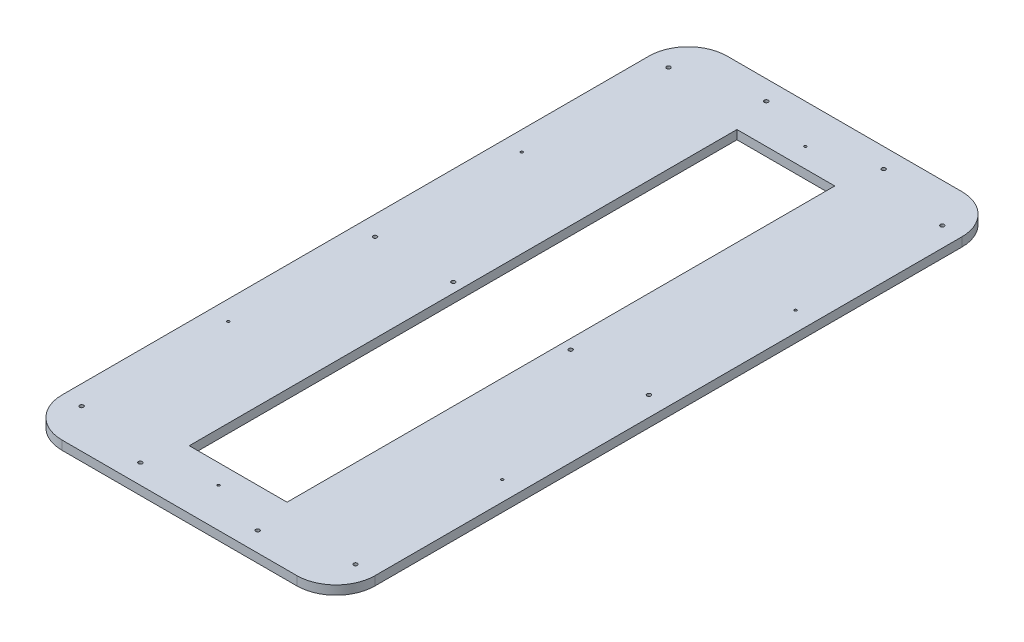
from build123d import *

# Parameters (mm, degrees)
SKETCH1_W                 = 203.2
SKETCH1_H                 = 431.8
BOSS_EXTRUDE1_DEPTH       = 5.8
M3X0_5_TAPPED_HOLE2_D     = 2.5
M3X0_5_TAPPED_HOLE2_DEPTH = 7.5
M3X0_5_TAPPED_HOLE2_TIP   = 0.751075774
SKETCH7_W                 = 63.5
SKETCH7_H                 = 355.6
CUT_EXTRUDE2_DEPTH        = 478.257917692
FILLET1_R                 = 25.4
M3X0_5_TAPPED_HOLE1_D     = 2.5
M3X0_5_TAPPED_HOLE1_DEPTH = 7.5
M3X0_5_TAPPED_HOLE1_TIP   = 0.751075774
SKETCH10_R                = 0.79375
CUT_EXTRUDE3_DEPTH        = 478.257917692


with BuildPart() as part:
    # Sketch1 → Boss-Extrude1 (new body)
    with BuildSketch(Plane(origin=(0, 0, 0), x_dir=(1, 0, 0), z_dir=(0, 1, 0))):
        with Locations((101.6, 215.9)):
            Rectangle(SKETCH1_W, SKETCH1_H)
    extrude(amount=BOSS_EXTRUDE1_DEPTH)

    # M3x0.5 Tapped Hole2
    with Locations(Plane(origin=(0, 5.8, 0), x_dir=(-1, 0, 0), z_dir=(0, 1, 0))):
        with Locations((-63.5, -419.1), (-139.7, -419.1), (-63.5, -215.9), (-139.7, -215.9), (-63.5, -12.7), (-139.7, -12.7)):
            Hole(M3X0_5_TAPPED_HOLE2_D / 2, depth=M3X0_5_TAPPED_HOLE2_DEPTH)
            with Locations((0, 0, -(M3X0_5_TAPPED_HOLE2_DEPTH + M3X0_5_TAPPED_HOLE2_TIP / 2))):  # 118° drill point
                Cone(0, M3X0_5_TAPPED_HOLE2_D / 2, M3X0_5_TAPPED_HOLE2_TIP, mode=Mode.SUBTRACT)

    # Sketch7 → Cut-Extrude2 (cut, through all)
    with BuildSketch(Plane(origin=(0, 5.8, 0), x_dir=(1, 0, 0), z_dir=(0, 1, 0))):
        with Locations((101.6, 215.9)):
            Rectangle(SKETCH7_W, SKETCH7_H)
    extrude(amount=-CUT_EXTRUDE2_DEPTH, mode=Mode.SUBTRACT)

    # Fillet1
    fillet1_edges = [part.edges().sort_by_distance(p)[0] for p in [
        (0, 2.9, -431.8),
        (203.2, 2.9, -431.8),
        (203.2, 2.9, 0),
        (0, 2.9, 0),
    ]]
    fillet(fillet1_edges, radius=FILLET1_R)

    # M3x0.5 Tapped Hole1
    with Locations(Plane(origin=(0, 5.8, 0), x_dir=(-1, 0, 0), z_dir=(0, 1, 0))):
        with Locations((-190.5, -406.4), (-190.5, -25.4), (-12.7, -25.4), (-12.7, -406.4), (-190.5, -215.9), (-12.7, -215.9)):
            Hole(M3X0_5_TAPPED_HOLE1_D / 2, depth=M3X0_5_TAPPED_HOLE1_DEPTH)
            with Locations((0, 0, -(M3X0_5_TAPPED_HOLE1_DEPTH + M3X0_5_TAPPED_HOLE1_TIP / 2))):  # 118° drill point
                Cone(0, M3X0_5_TAPPED_HOLE1_D / 2, M3X0_5_TAPPED_HOLE1_TIP, mode=Mode.SUBTRACT)

    # Sketch10 → Cut-Extrude3 (cut, through all)
    with BuildSketch(Plane(origin=(0, 5.8, 0), x_dir=(1, 0, 0), z_dir=(0, 1, 0))):
        with Locations(Location((12.7, 311.15, 0), (0, 0, 270))):
            Circle(SKETCH10_R)
        with Locations(Location((190.5, 311.15, 0), (0, 0, 270))):
            Circle(SKETCH10_R)
        with Locations(Location((101.6, 406.4, 0), (0, 0, 270))):
            Circle(SKETCH10_R)
        with Locations(Location((101.6, 25.4, 0), (0, 0, 90))):
            Circle(SKETCH10_R)
        with Locations(Location((190.5, 120.65, 0), (0, 0, 90))):
            Circle(SKETCH10_R)
        with Locations(Location((12.7, 120.65, 0), (0, 0, 90))):
            Circle(SKETCH10_R)
    extrude(amount=-CUT_EXTRUDE3_DEPTH, mode=Mode.SUBTRACT)


solid = part.part
